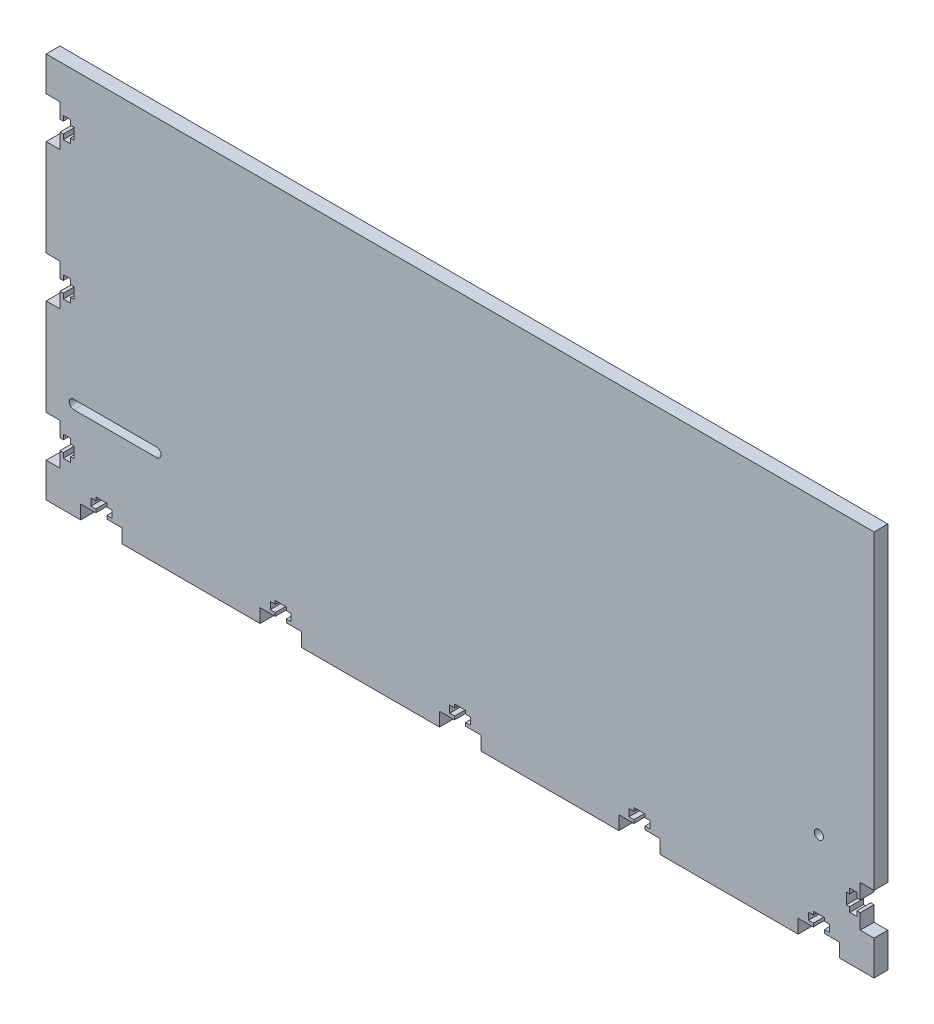
from build123d import *

# Parameters (mm, degrees)
SKETCH1_W           = 381
SKETCH1_H           = 177.8
BOSS_EXTRUDE1_DEPTH = 6.35
CUT_EXTRUDE1_DEPTH  = 421.492761531
CUT_EXTRUDE2_DEPTH  = 421.492761531
LPATTERN1_COUNT     = 5
LPATTERN1_PITCH     = 82.55
SKETCH7_R           = 2.1
CUT_EXTRUDE3_DEPTH  = 421.492761531
CUT_EXTRUDE4_DEPTH  = 421.492761531
LPATTERN3_COUNT     = 2
LPATTERN3_PITCH     = 63.5
CUT_EXTRUDE5_DEPTH  = 421.492761531


with BuildPart() as part:
    # Sketch1 → Boss-Extrude1 (new body)
    with BuildSketch(Plane.XY):
        with Locations((190.5, 88.9)):
            Rectangle(SKETCH1_W, SKETCH1_H)
    extrude(amount=BOSS_EXTRUDE1_DEPTH)

    # Sketch2 → Cut-Extrude1 (cut, through all)
    with BuildSketch(Plane.XY.offset(6.35)):
        with BuildLine():
            Line((12.7, 46.55), (50.8, 46.55))
            ThreePointArc((50.8, 46.55), (52.9, 44.45), (50.8, 42.35))
            Line((50.8, 42.35), (12.7, 42.35))
            ThreePointArc((12.7, 42.35), (10.6, 44.45), (12.7, 46.55))
        make_face()
    extrude(amount=-CUT_EXTRUDE1_DEPTH, mode=Mode.SUBTRACT)

    # Sketch6 → Cut-Extrude2 (cut, through all)
    with BuildSketch(Plane.XY.offset(6.35)):
        Polygon((15.875, 0), (34.925, 0), (34.925, 6.35), (27.94, 6.35), (27.94, 7.874), (30.226, 7.874), (30.226, 11.176), (27.94, 11.176), (27.94, 12.7), (22.86, 12.7), (22.86, 11.176), (20.574, 11.176), (20.574, 7.874), (22.86, 7.874), (22.86, 6.35), (15.875, 6.35), align=None)
    cut_extrude2 = extrude(amount=-CUT_EXTRUDE2_DEPTH, mode=Mode.SUBTRACT)

    # LPattern1: Cut-Extrude2 ×5
    with Locations(*[(i * LPATTERN1_PITCH, 0, 0) for i in range(1, LPATTERN1_COUNT)]):
        add(cut_extrude2, mode=Mode.SUBTRACT)

    # Sketch7 → Cut-Extrude3 (cut, through all)
    with BuildSketch(Plane.XY.offset(6.35)):
        with Locations((355.6, 44.45)):
            Circle(SKETCH7_R)
    extrude(amount=-CUT_EXTRUDE3_DEPTH, mode=Mode.SUBTRACT)

    # Sketch8 → Cut-Extrude4 (cut, through all)
    with BuildSketch(Plane.XY.offset(6.35)):
        Polygon((0, 161.925), (0, 142.875), (6.35, 142.875), (6.35, 149.86), (7.874, 149.86), (7.874, 147.574), (11.176, 147.574), (11.176, 149.86), (12.7, 149.86), (12.7, 154.94), (11.176, 154.94), (11.176, 157.226), (7.874, 157.226), (7.874, 154.94), (6.35, 154.94), (6.35, 161.925), align=None)
    cut_extrude4 = extrude(amount=-CUT_EXTRUDE4_DEPTH, mode=Mode.SUBTRACT)

    # LPattern3: Cut-Extrude4 ×2
    with Locations(*[(0, -i * LPATTERN3_PITCH, 0) for i in range(1, LPATTERN3_COUNT)]):
        add(cut_extrude4, mode=Mode.SUBTRACT)

    # Sketch9 → Cut-Extrude5 (cut, through all)
    with BuildSketch(Plane.XY.offset(6.35)):
        Polygon((0, 34.925), (0, 15.875), (6.35, 15.875), (6.35, 22.86), (7.874, 22.86), (7.874, 20.574), (11.176, 20.574), (11.176, 22.86), (12.7, 22.86), (12.7, 27.94), (11.176, 27.94), (11.176, 30.226), (7.874, 30.226), (7.874, 27.94), (6.35, 27.94), (6.35, 34.925), align=None)
    cut_extrude5 = extrude(amount=-CUT_EXTRUDE5_DEPTH, mode=Mode.SUBTRACT)

    # Mirror2: Cut-Extrude5 across plane
    add(cut_extrude5.mirror(Plane.ZY.offset(-190.5)), mode=Mode.SUBTRACT)


solid = part.part
